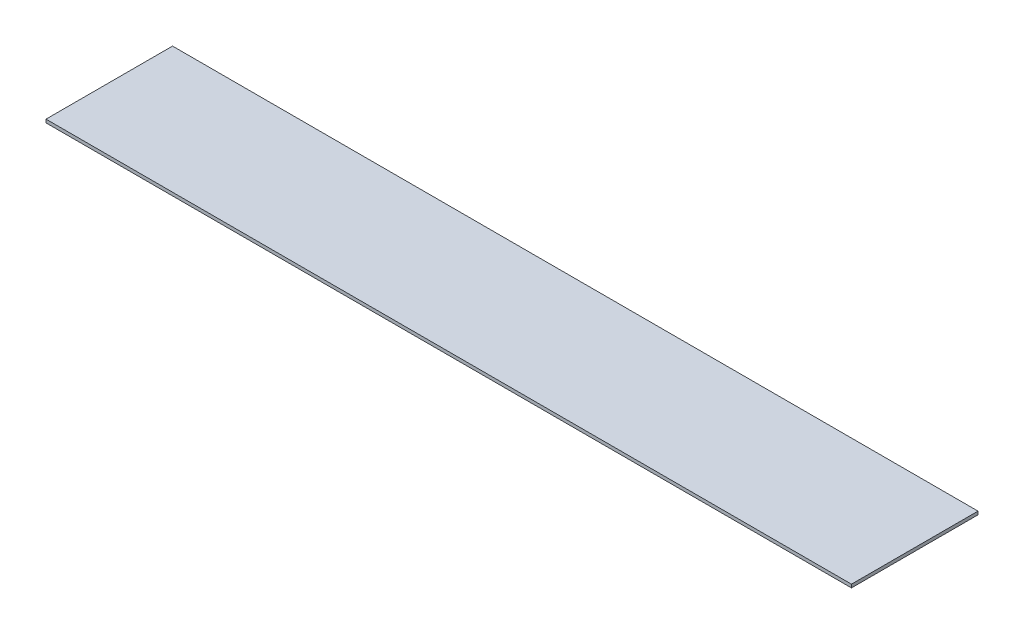
from build123d import *

# Parameters (mm, degrees)
SKETCH1_W           = 1176.274
SKETCH1_H           = 184.792366
BOSS_EXTRUDE2_DEPTH = 4.7625


with BuildPart() as part:
    # Sketch1 → Boss-Extrude2 (new body)
    with BuildSketch(Plane(origin=(0, 0, 0), x_dir=(1, 0, 0), z_dir=(0, 1, 0))):
        with Locations((529.008051813, 63.995664579)):
            Rectangle(SKETCH1_W, SKETCH1_H)
    extrude(amount=BOSS_EXTRUDE2_DEPTH)


solid = part.part
